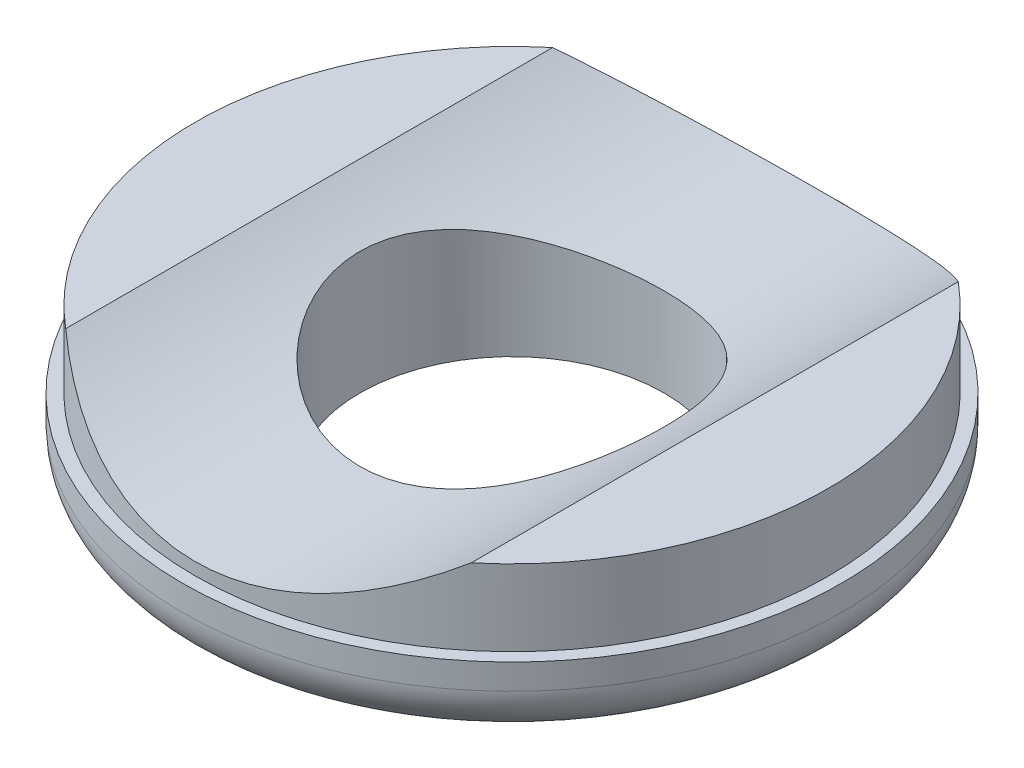
from build123d import *

# Parameters (mm, degrees)
SKETCH_1_R               = 6.5
EXTRUDE_1_DEPTH          = 1.5
FILLET_1_R               = 1
SKETCH_2_R               = 6.25
EXTRUDE_2_DEPTH          = 1.5
CUT_EXTRUDE_1_DEPTH      = 10.66953987
CUT_EXTRUDE_1_DEPTH_BACK = 10.66953987
SKETCH_4_R               = 3
CUT_EXTRUDE_2_DEPTH      = 10.669539901


with BuildPart() as part:
    # 草图1 → 凸台-拉伸1 (new body)
    with BuildSketch(Plane(origin=(0, 0, 0), x_dir=(1, 0, 0), z_dir=(0, 1, 0))):
        with Locations(Location((0, 0, 0), (0, 0, 270))):
            Circle(SKETCH_1_R)
    extrude(amount=EXTRUDE_1_DEPTH)

    # 圆角1
    fillet_1_edges = [part.edges().sort_by_distance(p)[0] for p in [
        (0, 0, -6.5),
    ]]
    fillet(fillet_1_edges, radius=FILLET_1_R)

    # 草图2 → 凸台-拉伸2 (add)
    with BuildSketch(Plane(origin=(0, 1.5, 0), x_dir=(1, 0, 0), z_dir=(0, 1, 0))):
        with Locations(Location((0, 0, 0), (0, 0, 270))):
            Circle(SKETCH_2_R)
    extrude(amount=EXTRUDE_2_DEPTH)

    # 草图3 → 切除-拉伸1 (cut, two sides: drawn at the far end of the back side and taken through both)
    with BuildSketch(Plane.XY.offset(-CUT_EXTRUDE_1_DEPTH_BACK)):
        with BuildLine():
            ThreePointArc((-4, 3), (-2.096194346, 2.065792605), (0, 1.744562647))
            Line((0, 1.744562647), (0, 3))
            Line((0, 3), (-4, 3))
        make_face()
        with BuildLine():
            Line((0, 3), (0, 1.744562647))
            ThreePointArc((0, 1.744562647), (2.096194346, 2.065792605), (4, 3))
            Line((4, 3), (0, 3))
        make_face()
    extrude(amount=CUT_EXTRUDE_1_DEPTH + CUT_EXTRUDE_1_DEPTH_BACK, mode=Mode.SUBTRACT)

    # 草图4 → 切除-拉伸2 (cut, through all)
    with BuildSketch(Plane.XZ):
        with Locations(Location((0, 0, 0), (0, 0, 270))):
            Circle(SKETCH_4_R)
    extrude(amount=-CUT_EXTRUDE_2_DEPTH, mode=Mode.SUBTRACT)


solid = part.part
